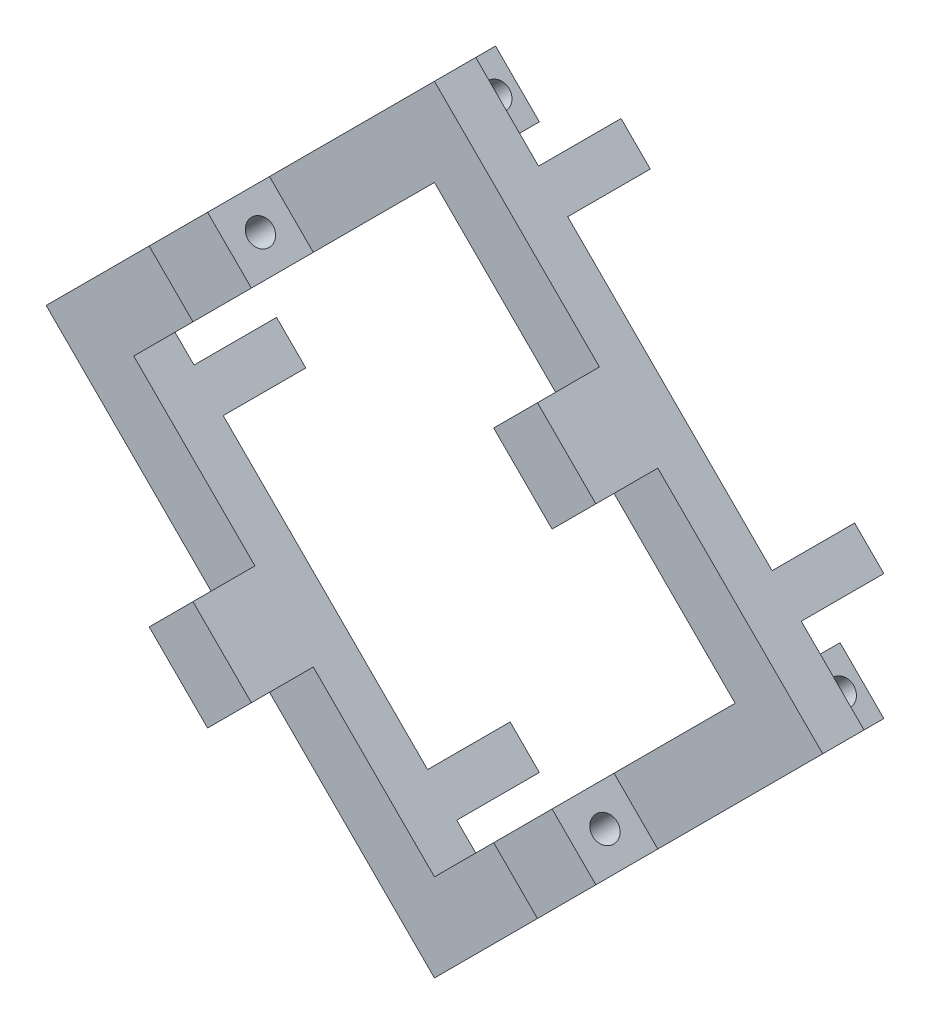
from build123d import *

# Parameters (mm, degrees)
SALIENTE_EXTRUIR1_DEPTH   = 20
SALIENTE_EXTRUIR1_2_DEPTH = 20
SALIENTE_EXTRUIR1_3_DEPTH = 20
SALIENTE_EXTRUIR1_4_DEPTH = 20
SALIENTE_EXTRUIR1_5_DEPTH = 20
SALIENTE_EXTRUIR1_6_DEPTH = 20
SALIENTE_EXTRUIR1_7_DEPTH = 20
SALIENTE_EXTRUIR1_8_DEPTH = 20
SALIENTE_EXTRUIR2_DEPTH   = 10
CROQUIS7_R                = 3
CORTAR_EXTRUIR2_DEPTH     = 80
CROQUIS8_R                = 3
CORTAR_EXTRUIR3_DEPTH     = 10
SIMETR_A4_COPY_1_SKETCH_R = 3
SIMETR_A4_COPY_1_DEPTH    = 80
SIMETR_A4_COPY_2_SKETCH_R = 3
SIMETR_A4_COPY_2_DEPTH    = 10
SALIENTE_EXTRUIR3_DEPTH   = 15
CROQUIS11_R               = 3
CORTAR_EXTRUIR4_DEPTH     = 150.913308282
CROQUIS13_R               = 3
CORTAR_EXTRUIR5_DEPTH     = 150.913308282


with BuildPart() as part:
    # Croquis1 → Saliente-Extruir1 (new body)
    with BuildSketch(Plane.XY):
        Polygon((-71.77133829, 22.273863607), (-61.164736573, 11.66726189), (-68.235804385, 4.596194078), (-78.842406102, 15.202795796), align=None)
    extrude(amount=SALIENTE_EXTRUIR1_DEPTH)



with BuildPart() as body_2:
    # Croquis1 → Saliente-Extruir1 2 (new body)
    with BuildSketch(Plane.XY):
        Polygon((-11.66726189, 61.164736573), (-4.596194078, 68.235804385), (-15.202795796, 78.842406102), (-22.273863607, 71.77133829), align=None)
    extrude(amount=SALIENTE_EXTRUIR1_2_DEPTH)


with BuildPart() as body_3:
    # Croquis1 → Saliente-Extruir1 3 (new body)
    with BuildSketch(Plane.XY):
        Polygon((22.273863607, 71.77133829), (11.66726189, 61.164736573), (4.596194078, 68.235804385), (15.202795796, 78.842406102), align=None)
    extrude(amount=SALIENTE_EXTRUIR1_3_DEPTH)


with BuildPart() as body_4:
    # Croquis1 → Saliente-Extruir1 4 (new body)
    with BuildSketch(Plane.XY):
        Polygon((61.164736573, 11.66726189), (68.235804385, 4.596194078), (78.842406102, 15.202795796), (71.77133829, 22.273863607), align=None)
    extrude(amount=SALIENTE_EXTRUIR1_4_DEPTH)


with BuildPart() as body_5:
    # Croquis1 → Saliente-Extruir1 5 (new body)
    with BuildSketch(Plane.XY):
        Polygon((71.77133829, -22.273863607), (61.164736573, -11.66726189), (68.235804385, -4.596194078), (78.842406102, -15.202795796), align=None)
    extrude(amount=SALIENTE_EXTRUIR1_5_DEPTH)


with BuildPart() as body_6:
    # Croquis1 → Saliente-Extruir1 6 (new body)
    with BuildSketch(Plane.XY):
        Polygon((11.66726189, -61.164736573), (4.596194078, -68.235804385), (15.202795796, -78.842406102), (22.273863607, -71.77133829), align=None)
    extrude(amount=SALIENTE_EXTRUIR1_6_DEPTH)


with BuildPart() as body_7:
    # Croquis1 → Saliente-Extruir1 7 (new body)
    with BuildSketch(Plane.XY):
        Polygon((-22.273863607, -71.77133829), (-11.66726189, -61.164736573), (-4.596194078, -68.235804385), (-15.202795796, -78.842406102), align=None)
    extrude(amount=SALIENTE_EXTRUIR1_7_DEPTH)


with BuildPart() as body_8:
    # Croquis1 → Saliente-Extruir1 8 (new body)
    with BuildSketch(Plane.XY):
        Polygon((-61.164736573, -11.66726189), (-68.235804385, -4.596194078), (-78.842406102, -15.202795796), (-71.77133829, -22.273863607), align=None)
    extrude(amount=SALIENTE_EXTRUIR1_8_DEPTH)


with BuildPart() as part_1:
    add(part.part)

    add(body_2.part)  # Saliente-Extruir2 merges body 2

    add(body_3.part)  # Saliente-Extruir2 merges body 3

    add(body_4.part)  # Saliente-Extruir2 merges body 4

    add(body_5.part)  # Saliente-Extruir2 merges body 5

    add(body_6.part)  # Saliente-Extruir2 merges body 6

    add(body_7.part)  # Saliente-Extruir2 merges body 7

    add(body_8.part)  # Saliente-Extruir2 merges body 8
    # Croquis2 → Saliente-Extruir2 (add)
    with BuildSketch(Plane.XY.offset(20)):
        Polygon((0, 94.045201898), (94.045201898, 0), (0, -94.045201898), (-94.045201898, 0), align=None)
        Polygon((0, 72.831998462), (72.831998462, 0), (0, -72.831998462), (-72.831998462, 0), align=None, mode=Mode.SUBTRACT)
    extrude(amount=SALIENTE_EXTRUIR2_DEPTH)

    # Croquis7 → Cortar-Extruir2 (cut)
    with BuildSketch(Plane(origin=(31.819805153, 31.819805153, 0), x_dir=(0, 0, -1), z_dir=(0.7071067811865476, 0.7071067811865476, 0))):
        with Locations(Location((-5, -59, 0), (0, 0, 90))):
            Circle(CROQUIS7_R)
    cortar_extruir2 = extrude(amount=-CORTAR_EXTRUIR2_DEPTH, mode=Mode.SUBTRACT)

    # Croquis8 → Cortar-Extruir3 (cut)
    with BuildSketch(Plane(origin=(31.819805153, -31.819805153, 0), x_dir=(0, 0, -1), z_dir=(0.7071067811865481, -0.707106781186547, 0))):
        with Locations(Location((-5, 59, 0), (0, 0, 90))):
            Circle(CROQUIS8_R)
    cortar_extruir3 = extrude(amount=-CORTAR_EXTRUIR3_DEPTH, mode=Mode.SUBTRACT)

    # Simetría3: Cortar-Extruir2, Cortar-Extruir3 across plane
    add(cortar_extruir2.mirror(Plane(origin=(0, 0, 0), x_dir=(0, 0, 1), z_dir=(0.7071067811865481, -0.707106781186547, 0))), mode=Mode.SUBTRACT)
    add(cortar_extruir3.mirror(Plane(origin=(0, 0, 0), x_dir=(0, 0, 1), z_dir=(0.7071067811865481, -0.707106781186547, 0))), mode=Mode.SUBTRACT)

    # Simetría4: Cortar-Extruir2, Cortar-Extruir3 across plane
    add(cortar_extruir2.mirror(Plane(origin=(0, 0, 0), x_dir=(0, 0, 1), z_dir=(-0.7071067811865477, -0.7071067811865475, 0))), mode=Mode.SUBTRACT)
    add(cortar_extruir3.mirror(Plane(origin=(0, 0, 0), x_dir=(0, 0, 1), z_dir=(-0.7071067811865477, -0.7071067811865475, 0))), mode=Mode.SUBTRACT)

    # Simetría4 copy 1 sketch → Simetría4 copy 1 (cut)
    with BuildSketch(Plane(origin=(-31.819805153, -31.819805153, 0), x_dir=(0, 0, -1), z_dir=(-0.7071067811865492, -0.7071067811865465, 0))):
        with Locations(Location((-5, -59, 0), (0, 0, 90))):
            Circle(SIMETR_A4_COPY_1_SKETCH_R)
    extrude(amount=-SIMETR_A4_COPY_1_DEPTH, mode=Mode.SUBTRACT)

    # Simetría4 copy 2 sketch → Simetría4 copy 2 (cut)
    with BuildSketch(Plane(origin=(-31.819805153, 31.819805153, 0), x_dir=(0, 0, -1), z_dir=(-0.7071067811865471, 0.7071067811865488, 0))):
        with Locations(Location((-5, 59, 0), (0, 0, 90))):
            Circle(SIMETR_A4_COPY_2_SKETCH_R)
    extrude(amount=-SIMETR_A4_COPY_2_DEPTH, mode=Mode.SUBTRACT)

    # Croquis10 → Saliente-Extruir3 (add)
    with BuildSketch(Plane.XY.offset(30)):
        Polygon((29.344931419, 43.487067043), (39.951533137, 54.093668761), (54.093668761, 39.951533137), (43.487067043, 29.344931419), align=None)
        Polygon((43.487067043, -29.344931419), (54.093668761, -39.951533137), (39.951533137, -54.093668761), (29.344931419, -43.487067043), align=None)
        Polygon((-29.344931419, -43.487067043), (-39.951533137, -54.093668761), (-54.093668761, -39.951533137), (-43.487067043, -29.344931419), align=None)
        Polygon((-43.487067043, 29.344931419), (-54.093668761, 39.951533137), (-39.951533137, 54.093668761), (-29.344931419, 43.487067043), align=None)
    extrude(amount=SALIENTE_EXTRUIR3_DEPTH)

    # Croquis11 → Cortar-Extruir4 (cut, through all)
    with BuildSketch(Plane(origin=(7.071067812, -7.071067812, 0), x_dir=(0, 0, -1), z_dir=(0.7071067811865481, -0.707106781186547, 0))):
        with Locations(Location((-37.5, 59, 0), (0, 0, 90))):
            Circle(CROQUIS11_R)
        with Locations(Location((-37.5, -59, 0), (0, 0, 90))):
            Circle(CROQUIS11_R)
    extrude(amount=-CORTAR_EXTRUIR4_DEPTH, mode=Mode.SUBTRACT)

    # Croquis13 → Cortar-Extruir5 (cut, through all)
    with BuildSketch(Plane(origin=(-7.071067812, -7.071067812, 0), x_dir=(0, 0, 1), z_dir=(-0.707106781186549, -0.707106781186546, 0))):
        with Locations(Location((37.5, -59, 0), (0, 0, 270))):
            Circle(CROQUIS13_R)
        with Locations(Location((37.5, 59, 0), (0, 0, 270))):
            Circle(CROQUIS13_R)
    extrude(amount=-CORTAR_EXTRUIR5_DEPTH, mode=Mode.SUBTRACT)


solid = part_1.part
